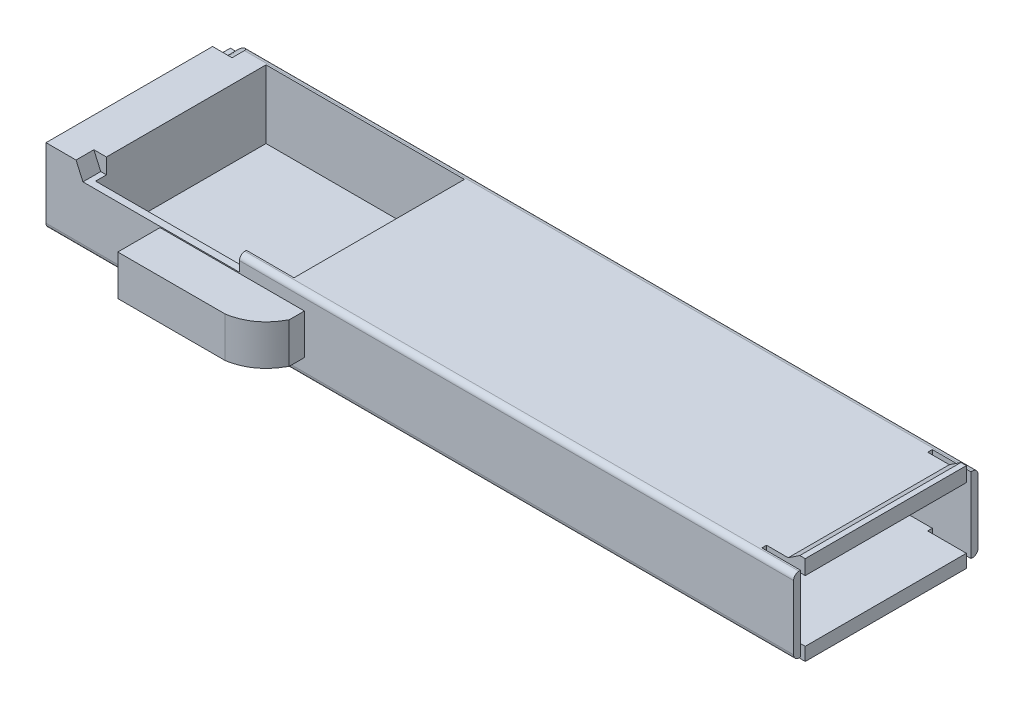
from build123d import *

# Parameters (mm, degrees)
SKETCH_1_W           = 23.8
SKETCH_1_H           = 9.7
SKETCH_1_W_2         = 22
SKETCH_1_H_2         = 7.9
EXTRUDE_1_DEPTH      = 93.5
SKETCH_5_W           = 30.862098313
SKETCH_5_H           = 22
CUT_EXTRUDE_1_DEPTH  = 5
EXTRUDE_3_DEPTH      = 3
EXTRUDE_3_DEPTH_BACK = 2.5
CUT_EXTRUDE_2_DEPTH  = 2.3
CUT_EXTRUDE_3_DEPTH  = 2.3
SKETCH_10_W          = 27.414514358
SKETCH_10_H          = 5.206733811
EXTRUDE_4_DEPTH      = 5.45
EXTRUDE_5_DEPTH      = 23.8
CUT_EXTRUDE_4_DEPTH  = 10
CUT_EXTRUDE_5_DEPTH  = 5
FILLET_2_R           = 0.7


with BuildPart() as part:
    # 草图1 → 凸台-拉伸1 (new body)
    with BuildSketch(Plane(origin=(0, 0, 0), x_dir=(0, 0, -1), z_dir=(1, 0, 0))):
        Rectangle(SKETCH_1_W, SKETCH_1_H)
        Rectangle(SKETCH_1_W_2, SKETCH_1_H_2, mode=Mode.SUBTRACT)
    extrude(amount=EXTRUDE_1_DEPTH)

    # 草图5 → 切除-拉伸1 (cut)
    with BuildSketch(Plane(origin=(0, 4.85, 0), x_dir=(1, 0, 0), z_dir=(0, 1, 0))):
        with Locations((12.679771903, 0)):
            Rectangle(SKETCH_5_W, SKETCH_5_H)
    extrude(amount=-CUT_EXTRUDE_1_DEPTH, mode=Mode.SUBTRACT)

    # 草图7 → 凸台-拉伸3 (add, two sides: drawn at the far end of the back side and taken through both)
    with BuildSketch(Plane.ZY.offset(-EXTRUDE_3_DEPTH_BACK)):
        Polygon((-11, 4.85), (11, 4.85), (11.9, 4.85), (11.9, -4.85), (-11.9, -4.85), (-11.9, 4.85), align=None)
    extrude(amount=EXTRUDE_3_DEPTH + EXTRUDE_3_DEPTH_BACK)

    # 草图8 → 切除-拉伸2 (cut)
    with BuildSketch(Plane.XY.offset(11.9)):
        Polygon((0.878787233, 4.85), (1.766547003, 2.85), (21.968929262, 2.85), (21.968929262, 4.85), align=None)
    extrude(amount=-CUT_EXTRUDE_2_DEPTH, mode=Mode.SUBTRACT)

    # 草图9 → 切除-拉伸3 (cut)
    with BuildSketch(Plane(origin=(0, 0, -11.9), x_dir=(-1, 0, 0), z_dir=(0, 0, -1))):
        with BuildLine():
            Line((2.347261018, 3.516538115), (3, 3.516538115))
            Line((3, 3.516538115), (3, 4.85))
            Line((3, 4.85), (0.483692493, 4.85))
            add(Edge.make_bspline(
                [(0.483692493, 4.85), (1.57048018, 4.409488755), (2.347261018, 3.516538115)],
                knots=[0, 0, 0, 1, 1, 1], degree=2))
        make_face()
    extrude(amount=-CUT_EXTRUDE_3_DEPTH, mode=Mode.SUBTRACT)

    # 草图10 → 凸台-拉伸4 (add)
    with BuildSketch(Plane.XY.offset(11.9)):
        with Locations((17.041287755, 0.106962124)):
            Rectangle(SKETCH_10_W, SKETCH_10_H)
    extrude(amount=EXTRUDE_4_DEPTH)

    # 草图11 → 凸台-拉伸5 (add)
    with BuildSketch(Plane(origin=(0, 0, -11.9), x_dir=(-1, 0, 0), z_dir=(0, 0, -1))):
        Polygon((-93.5, -4.85), (-93.5, -5.65), (-92.9, -5.65), (-91.3, -4.85), align=None)
        Polygon((-91.3, 4.85), (-92.8, 5.85), (-93.5, 5.85), (-93.5, 4.85), align=None)
    extrude(amount=-EXTRUDE_5_DEPTH)

    # 草图12 → 切除-拉伸4 (cut)
    with BuildSketch(Plane(origin=(0, 2.71032903, 0), x_dir=(1, 0, 0), z_dir=(0, 1, 0))):
        with BuildLine():
            Line((30.354179143, -13.864715533), (30.354179143, -11.9))
            Line((30.354179143, -11.9), (31.029316872, -11.9))
            Line((31.029316872, -11.9), (31.273931991, -17.729634416))
            Line((31.273931991, -17.729634416), (25.559722807, -17.35))
            add(Edge.make_bspline(
                [(25.559722807, -17.35), (28.738846795, -16.858311071), (30.354179143, -13.864715533)],
                knots=[0, 0, 0, 1, 1, 1], degree=2))
        make_face()
        Polygon((11.717782686, -17.35), (11.717782686, -11.9), (1.430390108, -11.9), (1.430390108, -18.181001755), align=None)
    extrude(amount=-CUT_EXTRUDE_4_DEPTH, mode=Mode.SUBTRACT)

    # 草图14 → 切除-拉伸5 (cut)
    with BuildSketch(Plane(origin=(93.5, 0, 0), x_dir=(0, 0, -1), z_dir=(1, 0, 0))):
        Polygon((-11, 5.85), (-11.9, 5.85), (-11.9, 4.85), (-11, 4.85), (-11, -4.85), (-11.9, -4.85), (-11.9, -5.65), (-11, -5.65), (-10.4, -5.65), (-10.4, 5.85), align=None)
        Polygon((11.9, 5.85), (11, 5.85), (10.4, 5.85), (10.4, -5.65), (11, -5.65), (11.9, -5.65), (11.9, -4.85), (11, -4.85), (11, 4.85), (11.9, 4.85), align=None)
    extrude(amount=-CUT_EXTRUDE_5_DEPTH, mode=Mode.SUBTRACT)

    # 圆角2
    fillet_2_edges = [part.edges().sort_by_distance(p)[0] for p in [
        (46.508153753, 4.85, -11.9),
        (45.25, -4.85, -11.9),
        (45.25, -4.85, 11.9),
        (57.734464631, 4.85, 11.9),
    ]]
    fillet(fillet_2_edges, radius=FILLET_2_R)


solid = part.part
